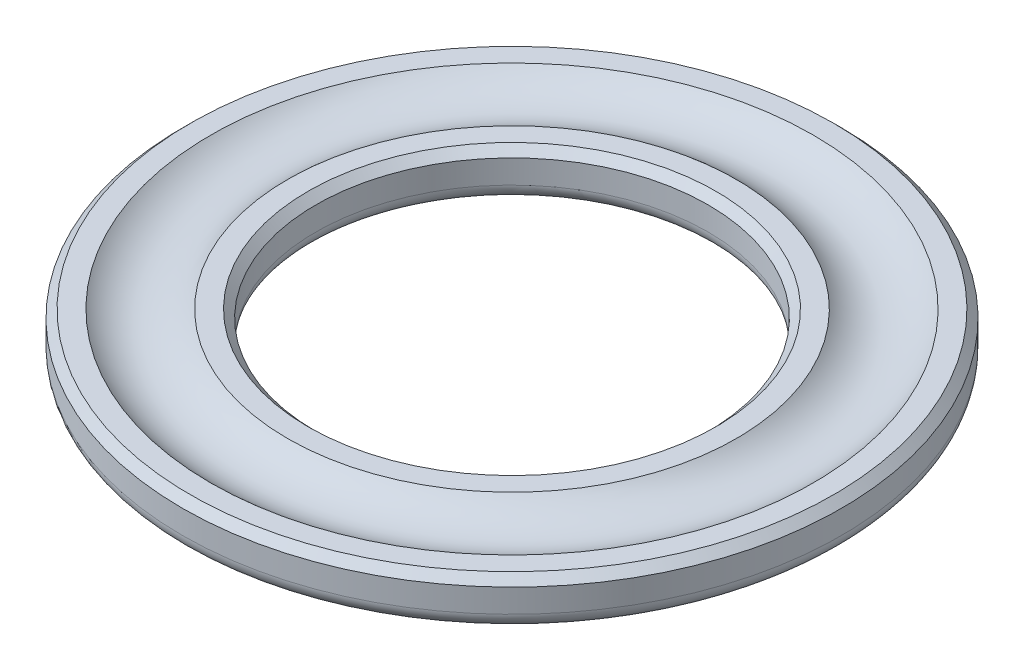
from build123d import *

# Parameters (mm, degrees)
CHAMFER1_SIZE = 0.5
FILLET2_R     = 1


with BuildPart() as part:
    # Sketch1 → Revolve1 (revolve)
    with BuildSketch(Plane.XY, mode=Mode.PRIVATE) as revolve1_sk:
        with BuildLine():
            Line((12.5, -2.5), (14.300510257, -2.5))
            ThreePointArc((14.300510257, -2.5), (16.75, -3.5), (19.199489743, -2.5))
            Line((19.199489743, -2.5), (21, -2.5))
            Line((21, -2.5), (21, -5.5))
            Line((21, -5.5), (12.5, -5.5))
            Line((12.5, -5.5), (12.5, -2.5))
        make_face()
    revolve(revolve1_sk.sketch.rotate(Axis((0, 5.5, 0), (0, -1, 0)), 90), axis=Axis((0, 5.5, 0), (0, -1, 0)))

    # Chamfer1
    chamfer1_edges = [part.edges().sort_by_distance(p)[0] for p in [
        (0, -2.5, -12.5),
        (0, -2.5, -21),
    ]]
    chamfer(chamfer1_edges, length=CHAMFER1_SIZE)

    # Fillet2
    fillet2_edges = [part.edges().sort_by_distance(p)[0] for p in [
        (0, -5.5, -21),
        (0, -5.5, -12.5),
    ]]
    fillet(fillet2_edges, radius=FILLET2_R)


solid = part.part
